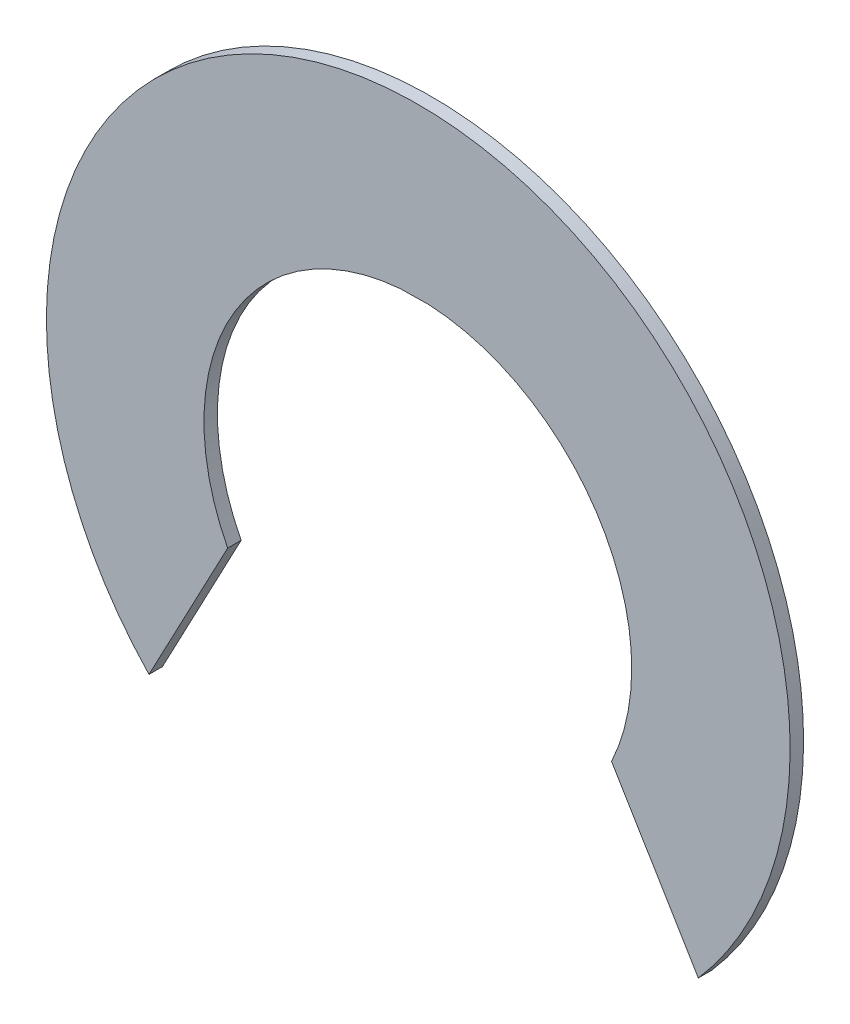
from build123d import *

# Parameters (mm, degrees)
EXTRUDE_1_DEPTH = 4


with BuildPart() as part:
    # 草图1 → 凸台-拉伸1 (new body)
    with BuildSketch(Plane.XY):
        with BuildLine():
            Line((-5.397698839, 62.227212363), (3.130167912, 62.378338545))
            ThreePointArc((3.130167912, 62.378338545), (54.435497436, 31.681412593), (57.550515021, -28.024824651))
            Line((57.550515021, -28.024824651), (83.337450501, -70.862121001))
            ThreePointArc((83.337450501, -70.862121001), (-2.251823992, 112.293181891), (-79.900175711, -74.367264806))
            Line((-79.900175711, -74.367264806), (-56.516746339, -30.172070148))
            ThreePointArc((-56.516746339, -30.172070148), (-55.617119883, 29.670430953), (-5.397698839, 62.227212363))
        make_face()
    extrude(amount=EXTRUDE_1_DEPTH)


solid = part.part
